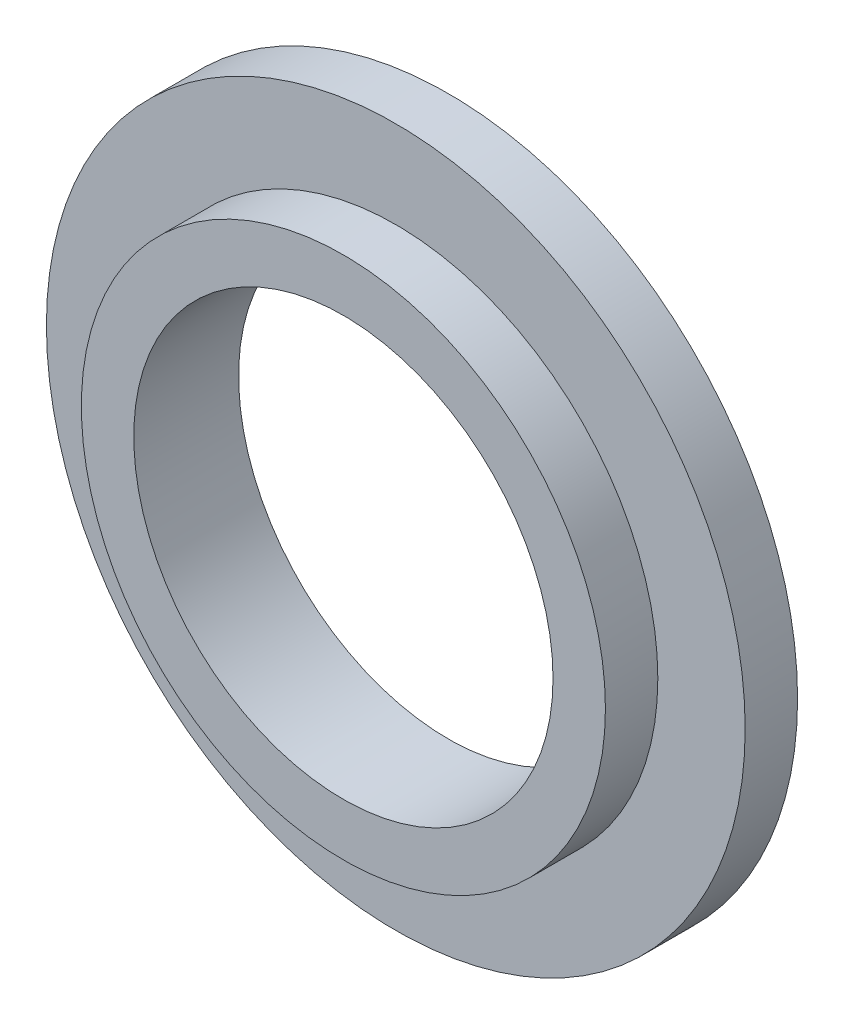
from build123d import *

# Parameters (mm, degrees)
SKETCH1_R           = 10
SKETCH1_R_2         = 6
BOSS_EXTRUDE1_DEPTH = 1.5
SKETCH2_R           = 7.5
SKETCH2_R_2         = 6
BOSS_EXTRUDE2_DEPTH = 1.5


with BuildPart() as part:
    # Sketch1 → Boss-Extrude1 (new body)
    with BuildSketch(Plane.XY):
        Circle(SKETCH1_R)
        Circle(SKETCH1_R_2, mode=Mode.SUBTRACT)
    extrude(amount=BOSS_EXTRUDE1_DEPTH)

    # Sketch2 → Boss-Extrude2 (add)
    with BuildSketch(Plane.XY.offset(1.5)):
        Circle(SKETCH2_R)
        Circle(SKETCH2_R_2, mode=Mode.SUBTRACT)
    extrude(amount=BOSS_EXTRUDE2_DEPTH)


solid = part.part
